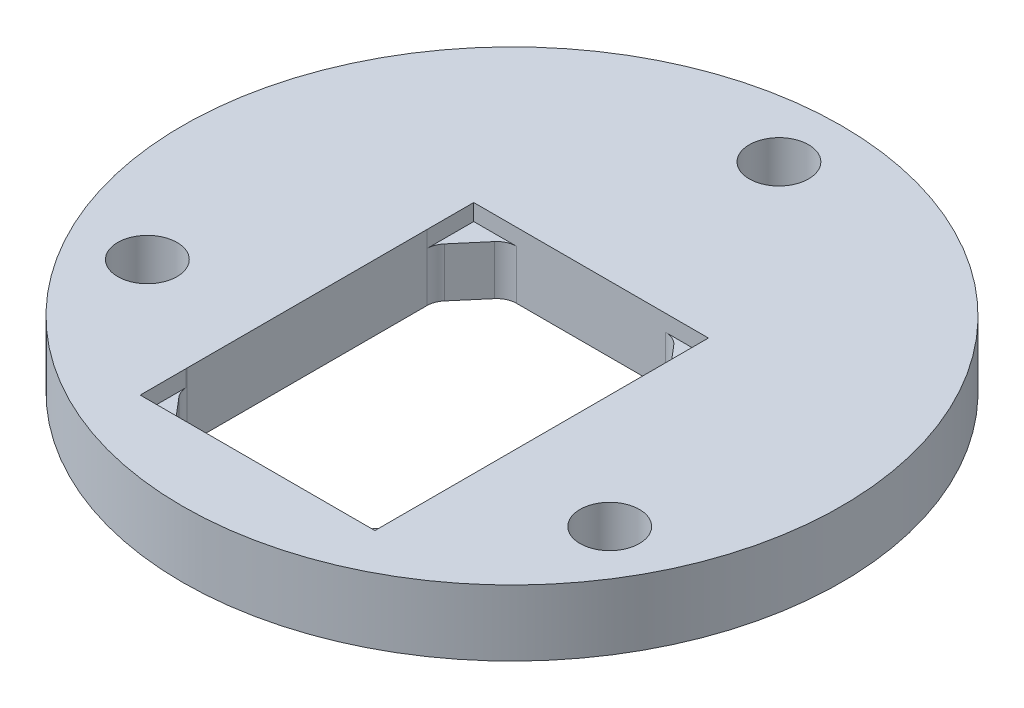
from build123d import *

# Parameters (mm, degrees)
SKETCH1_R           = 50
BOSS_EXTRUDE1_DEPTH = 10
CUT_EXTRUDE1_DEPTH  = 35
SKETCH5_W           = 35.6075
SKETCH5_H           = 50.6
CUT_EXTRUDE2_DEPTH  = 2.5
SKETCH7_R           = 4.5
CUT_EXTRUDE3_DEPTH  = 10
SKETCH7_3_R         = 4.5
CUT_EXTRUDE4_DEPTH  = 10
SKETCH7_4_R         = 4.5
CUT_EXTRUDE5_DEPTH  = 10


with BuildPart() as part:
    # Sketch1 → Boss-Extrude1 (new body)
    with BuildSketch(Plane(origin=(0, 0, 0), x_dir=(1, 0, 0), z_dir=(0, 1, 0))):
        with Locations((-8.682864084, 10.831764098)):
            Circle(SKETCH1_R)
    extrude(amount=BOSS_EXTRUDE1_DEPTH)

    # Sketch2 → Cut-Extrude1 (cut)
    with BuildSketch(Plane(origin=(0, 10, 0), x_dir=(1, 0, 0), z_dir=(0, 1, 0))):
        with BuildLine():
            Line((-20.002864084, -27.768235902), (2.632135916, -27.768235902))
            ThreePointArc((2.632135916, -27.768235902), (3.890371505, -27.491624086), (4.91657854, -26.712798037))
            Line((4.91657854, -26.712798037), (8.40657854, -22.612798037))
            ThreePointArc((8.40657854, -22.612798037), (8.937569086, -21.704255238), (9.122135916, -20.668235902))
            Line((9.122135916, -20.668235902), (9.122135916, 15.721764098))
            ThreePointArc((9.122135916, 15.721764098), (8.938191307, 16.756090949), (8.40891456, 17.663578567))
            Line((8.40891456, 17.663578567), (4.91891456, 21.773578567))
            ThreePointArc((4.91891456, 21.773578567), (3.892008249, 22.554395492), (2.632135916, 22.831764098))
            Line((2.632135916, 22.831764098), (-19.997864084, 22.831764098))
            ThreePointArc((-19.997864084, 22.831764098), (-21.255584517, 22.555390231), (-22.28157091, 21.777190306))
            Line((-22.28157091, 21.777190306), (-25.774070917, 17.677396608))
            ThreePointArc((-25.774070917, 17.677396608), (-26.30563684, 16.768425583), (-26.490364084, 15.731764356))
            Line((-26.490364084, 15.731764356), (-26.492864056, -20.667823814))
            ThreePointArc((-26.492864056, -20.667823814), (-26.308368402, -21.704061868), (-25.777306707, -22.612798037))
            Line((-25.777306707, -22.612798037), (-22.287306707, -26.712798037))
            ThreePointArc((-22.287306707, -26.712798037), (-21.261099672, -27.491624086), (-20.002864084, -27.768235902))
        make_face()
    extrude(amount=-CUT_EXTRUDE1_DEPTH, mode=Mode.SUBTRACT)

    # Sketch5 → Cut-Extrude2 (cut)
    with BuildSketch(Plane(origin=(0, 10, 0), x_dir=(1, 0, 0), z_dir=(0, 1, 0))):
        with Locations((-8.686614084, -2.468235902)):
            Rectangle(SKETCH5_W, SKETCH5_H)
    extrude(amount=-CUT_EXTRUDE2_DEPTH, mode=Mode.SUBTRACT)

    # Sketch7 → Cut-Extrude3 (cut)
    with BuildSketch(Plane(origin=(0, 10, 0), x_dir=(1, 0, 0), z_dir=(0, 1, 0))):
        with Locations((26.391164769, -9.418235902)):
            Circle(SKETCH7_R)
    extrude(amount=-CUT_EXTRUDE3_DEPTH, mode=Mode.SUBTRACT)

    # Sketch7<3> → Cut-Extrude4 (cut)
    with BuildSketch(Plane(origin=(0, 10, 0), x_dir=(1, 0, 0), z_dir=(0, 1, 0))):
        with Locations((-43.756892937, -9.418235902)):
            Circle(SKETCH7_3_R)
    extrude(amount=-CUT_EXTRUDE4_DEPTH, mode=Mode.SUBTRACT)

    # Sketch7<4> → Cut-Extrude5 (cut)
    with BuildSketch(Plane(origin=(0, 10, 0), x_dir=(1, 0, 0), z_dir=(0, 1, 0))):
        with Locations((-8.682864084, 51.331764098)):
            Circle(SKETCH7_4_R)
    extrude(amount=-CUT_EXTRUDE5_DEPTH, mode=Mode.SUBTRACT)


solid = part.part
